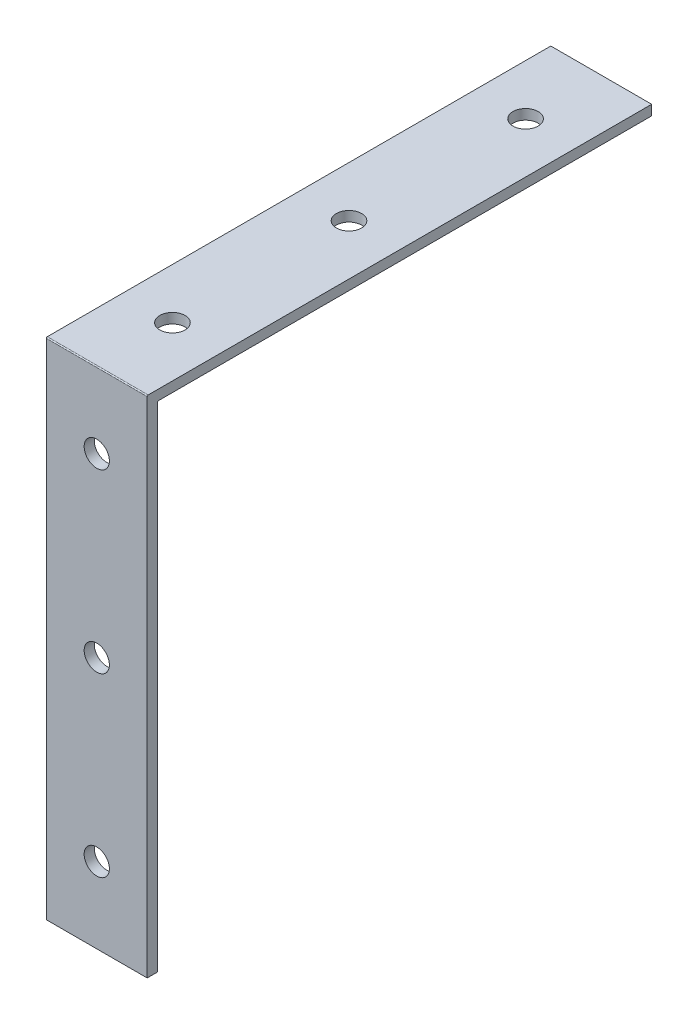
from build123d import *

# Parameters (mm, degrees)
EXTRUSION1_DEPTH = 20
HOLE1_D          = 5
HOLE2_D          = 5


with BuildPart() as part:
    # Sketch1 → Extrusion1 (new body)
    with BuildSketch(Plane.YZ):
        with BuildLine():
            Line((0, -100), (0, -0.2))
            ThreePointArc((0, -0.2), (-0.058578644, -0.058578644), (-0.2, 0))
            Line((-0.2, 0), (-100, 0))
            Line((-100, 0), (-100, -2))
            Line((-100, -2), (-2.2, -2))
            ThreePointArc((-2.2, -2), (-2.058578644, -2.058578644), (-2, -2.2))
            Line((-2, -2.2), (-2, -100))
            Line((-2, -100), (0, -100))
        make_face()
    extrude(amount=EXTRUSION1_DEPTH)

    # Hole1 (through all)
    with Locations(Plane(origin=(0, 0, 0), x_dir=(1, 0, 0), z_dir=(0, 1, 0))):
        with Locations((10, 15), (10, 50), (10, 85)):
            Hole(HOLE1_D / 2)

    # Hole2 (through all)
    with Locations(Plane.XY):
        with Locations((10, -85), (10, -50), (10, -15)):
            Hole(HOLE2_D / 2)


solid = part.part
